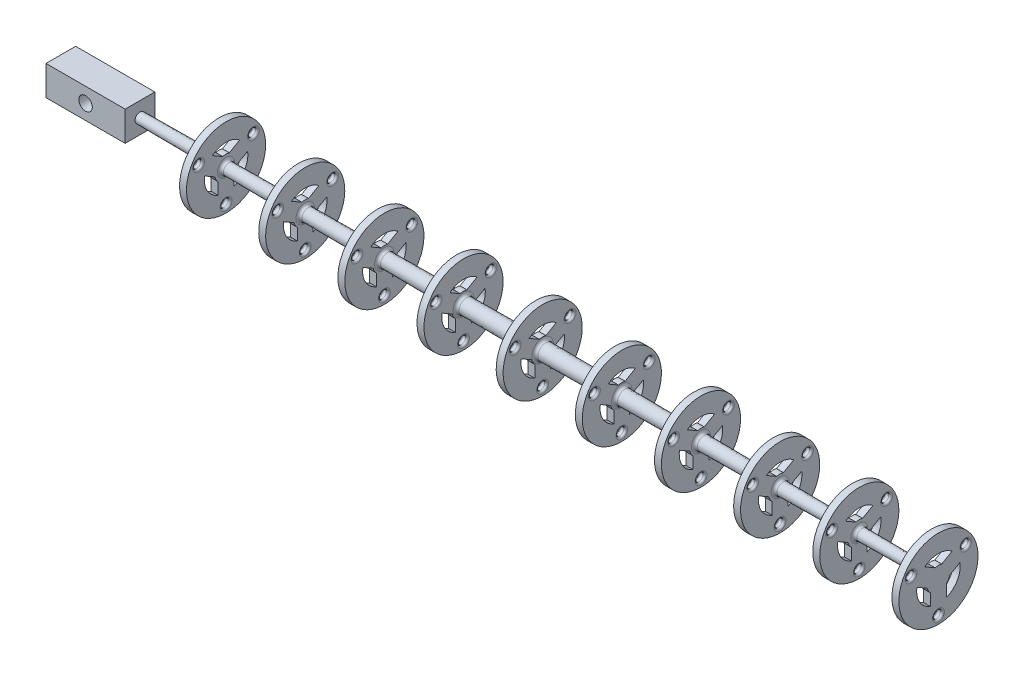
from build123d import *

# Parameters (mm, degrees)
SKETCH3_W                      = 1.75
SKETCH3_H                      = 10
CUT_EXTRUDE1_REACH             = 180.81
SKETCH5_R                      = 1
FILLET1_R                      = 0.5
LPATTERN1_COUNT                = 10
LPATTERN1_PITCH                = 20
FILLET1_OF_LPATTERN1_R         = 0.5
SKETCH16_W                     = 7.5
SKETCH16_H                     = 7.5
BOSS_EXTRUDE1_DEPTH            = 20
M3_CLEARANCE_HOLE1_D           = 3.4
M3_CLEARANCE_HOLE1_CSINK_D     = 3.45
M3_CLEARANCE_HOLE1_CSINK_ANGLE = 90
FILLET2_R                      = 0.75


with BuildPart() as part:
    # Sketch2 → Revolve1 (revolve)
    with BuildSketch(Plane.XY):
        Polygon((0, 1.25), (100, 2), (200, 1.25), (200, 0), (100, 0), (0, 0), align=None)
    revolve(axis=Axis((100, 0, 0), (-1, 0, 0)))

    # Sketch3 → Revolve2 (revolve)
    with BuildSketch(Plane.XY):
        with Locations((20.875, 5)):
            Rectangle(SKETCH3_W, SKETCH3_H)
    revolve2 = revolve(axis=Axis((21.75, 0, 0), (-1, 0, 0)))

    # Sketch5 → Cut-Extrude1 (cut, up to next)
    with BuildSketch(Plane(origin=(21.75, 0, 0), x_dir=(0, 0, -1), z_dir=(1, 0, 0)), mode=Mode.PRIVATE) as cut_extrude1_sk1:
        with Locations((0, -8)):
            Circle(SKETCH5_R)
    cut_extrude1_tool1 = extrude(cut_extrude1_sk1.sketch, amount=-CUT_EXTRUDE1_REACH, mode=Mode.PRIVATE) & part.part
    # Sketch5 → Cut-Extrude1 (cut, up to next)
    with BuildSketch(Plane(origin=(21.75, 0, 0), x_dir=(0, 0, -1), z_dir=(1, 0, 0)), mode=Mode.PRIVATE) as cut_extrude1_sk2:
        with Locations((6.92820323, 4)):
            Circle(SKETCH5_R)
    cut_extrude1_tool2 = extrude(cut_extrude1_sk2.sketch, amount=-CUT_EXTRUDE1_REACH, mode=Mode.PRIVATE) & part.part
    # Sketch5 → Cut-Extrude1 (cut, up to next)
    with BuildSketch(Plane(origin=(21.75, 0, 0), x_dir=(0, 0, -1), z_dir=(1, 0, 0)), mode=Mode.PRIVATE) as cut_extrude1_sk3:
        with Locations((-6.92820323, 4)):
            Circle(SKETCH5_R)
    cut_extrude1_tool3 = extrude(cut_extrude1_sk3.sketch, amount=-CUT_EXTRUDE1_REACH, mode=Mode.PRIVATE) & part.part
    # Sketch5 → Cut-Extrude1 (cut, up to next)
    with BuildSketch(Plane(origin=(21.75, 0, 0), x_dir=(0, 0, -1), z_dir=(1, 0, 0)), mode=Mode.PRIVATE) as cut_extrude1_sk4:
        with BuildLine():
            Line((-3.437059837, 4.293788499), (-0.834318116, 2.791094865))
            ThreePointArc((-0.834318116, 2.791094865), (0, 2.913125), (0.834318116, 2.791094865))
            Line((0.834318116, 2.791094865), (3.437059837, 4.293788499))
            ThreePointArc((3.437059837, 4.293788499), (0, 5.5), (-3.437059837, 4.293788499))
        make_face()
    cut_extrude1_tool4 = extrude(cut_extrude1_sk4.sketch, amount=-CUT_EXTRUDE1_REACH, mode=Mode.PRIVATE) & part.part
    # Sketch5 → Cut-Extrude1 (cut, up to next)
    with BuildSketch(Plane(origin=(21.75, 0, 0), x_dir=(0, 0, -1), z_dir=(1, 0, 0)), mode=Mode.PRIVATE) as cut_extrude1_sk5:
        with BuildLine():
            Line((2, -2.118088116), (2, -5.123475383))
            ThreePointArc((2, -5.123475383), (4.763139721, -2.75), (5.437059837, 0.829686884))
            Line((5.437059837, 0.829686884), (2.834318116, -0.67300675))
            ThreePointArc((2.834318116, -0.67300675), (2.522840254, -1.4565625), (2, -2.118088116))
        make_face()
    cut_extrude1_tool5 = extrude(cut_extrude1_sk5.sketch, amount=-CUT_EXTRUDE1_REACH, mode=Mode.PRIVATE) & part.part
    # Sketch5 → Cut-Extrude1 (cut, up to next)
    with BuildSketch(Plane(origin=(21.75, 0, 0), x_dir=(0, 0, -1), z_dir=(1, 0, 0)), mode=Mode.PRIVATE) as cut_extrude1_sk6:
        with BuildLine():
            Line((-2.834318116, -0.67300675), (-5.437059837, 0.829686884))
            ThreePointArc((-5.437059837, 0.829686884), (-4.763139721, -2.75), (-2, -5.123475383))
            Line((-2, -5.123475383), (-2, -2.118088116))
            ThreePointArc((-2, -2.118088116), (-2.522840254, -1.4565625), (-2.834318116, -0.67300675))
        make_face()
    cut_extrude1_tool6 = extrude(cut_extrude1_sk6.sketch, amount=-CUT_EXTRUDE1_REACH, mode=Mode.PRIVATE) & part.part
    cut_extrude1_1 = cut_extrude1_tool1.solids().sort_by_distance((21.75, -8, 0))[0]
    add(cut_extrude1_1, mode=Mode.SUBTRACT)
    cut_extrude1_2 = cut_extrude1_tool2.solids().sort_by_distance((21.75, 4, -6.928203))[0]
    add(cut_extrude1_2, mode=Mode.SUBTRACT)
    cut_extrude1_3 = cut_extrude1_tool3.solids().sort_by_distance((21.75, 4, 6.928203))[0]
    add(cut_extrude1_3, mode=Mode.SUBTRACT)
    cut_extrude1_4 = cut_extrude1_tool4.solids().sort_by_distance((21.75, 4.219627, 0))[0]
    add(cut_extrude1_4, mode=Mode.SUBTRACT)
    cut_extrude1_5 = cut_extrude1_tool5.solids().sort_by_distance((21.75, -2.109813, -3.654304))[0]
    add(cut_extrude1_5, mode=Mode.SUBTRACT)
    cut_extrude1_6 = cut_extrude1_tool6.solids().sort_by_distance((21.75, -2.109813, 3.654304))[0]
    add(cut_extrude1_6, mode=Mode.SUBTRACT)
    cut_extrude1 = cut_extrude1_1 + cut_extrude1_2 + cut_extrude1_3 + cut_extrude1_4 + cut_extrude1_5 + cut_extrude1_6  # Cut-Extrude1 as one shape, for the pattern or mirror that repeats it

    # Fillet1
    fillet1_edges = [part.edges().sort_by_distance(p)[0] for p in [
        (20, 4, -5.92820323),
        (20, -8, 1),
        (21.75, -8, 1),
        (21.75, 4, -5.92820323),
        (20, 4, 7.92820323),
        (21.75, 4, 7.92820323),
    ]]
    fillet(fillet1_edges, radius=FILLET1_R)

    # LPattern1: Revolve2, Cut-Extrude1 ×10
    with Locations(*[(i * LPATTERN1_PITCH, 0, 0) for i in range(1, LPATTERN1_COUNT)]):
        add(revolve2)
        add(cut_extrude1, mode=Mode.SUBTRACT)

    # Fillet1 of LPattern1
    fillet1_of_lpattern1_edges = [part.edges().sort_by_distance(p)[0] for p in [
        (40, 4, -5.92820323),
        (40, -8, 1),
        (41.75, -8, 1),
        (41.75, 4, -5.92820323),
        (40, 4, 7.92820323),
        (41.75, 4, 7.92820323),
        (60, 4, -5.92820323),
        (60, -8, 1),
        (61.75, -8, 1),
        (61.75, 4, -5.92820323),
        (60, 4, 7.92820323),
        (61.75, 4, 7.92820323),
        (80, 4, -5.92820323),
        (80, -8, 1),
        (81.75, -8, 1),
        (81.75, 4, -5.92820323),
        (80, 4, 7.92820323),
        (81.75, 4, 7.92820323),
        (100, 4, -5.92820323),
        (100, -8, 1),
        (101.75, -8, 1),
        (101.75, 4, -5.92820323),
        (100, 4, 7.92820323),
        (101.75, 4, 7.92820323),
        (120, 4, -5.92820323),
        (120, -8, 1),
        (121.75, -8, 1),
        (121.75, 4, -5.92820323),
        (120, 4, 7.92820323),
        (121.75, 4, 7.92820323),
        (140, 4, -5.92820323),
        (140, -8, 1),
        (141.75, -8, 1),
        (141.75, 4, -5.92820323),
        (140, 4, 7.92820323),
        (141.75, 4, 7.92820323),
        (160, 4, -5.92820323),
        (160, -8, 1),
        (161.75, -8, 1),
        (161.75, 4, -5.92820323),
        (160, 4, 7.92820323),
        (161.75, 4, 7.92820323),
        (180, 4, -5.92820323),
        (180, -8, 1),
        (181.75, -8, 1),
        (181.75, 4, -5.92820323),
        (180, 4, 7.92820323),
        (181.75, 4, 7.92820323),
        (200, 4, -5.92820323),
        (200, -8, 1),
        (201.75, -8, 1),
        (201.75, 4, -5.92820323),
        (200, 4, 7.92820323),
        (201.75, 4, 7.92820323),
    ]]
    fillet(fillet1_of_lpattern1_edges, radius=FILLET1_OF_LPATTERN1_R)

    # Sketch16 → Boss-Extrude1 (add)
    with BuildSketch(Plane.ZY):
        Rectangle(SKETCH16_W, SKETCH16_H)
    extrude(amount=BOSS_EXTRUDE1_DEPTH)

    # M3 Clearance Hole1 (through all)
    with Locations(Plane(origin=(0, 0, -3.75), x_dir=(-1, 0, 0), z_dir=(0, 0, -1))):
        with Locations((10, 0)):
            CounterSinkHole(M3_CLEARANCE_HOLE1_D / 2, M3_CLEARANCE_HOLE1_CSINK_D / 2, counter_sink_angle=M3_CLEARANCE_HOLE1_CSINK_ANGLE)

    # Fillet2
    fillet2_edges = [part.edges().sort_by_distance(p)[0] for p in [
        (20, -1.4, 0),
        (21.75, -1.413125, 0),
        (40, -1.55, 0),
        (41.75, -1.563125, 0),
        (60, -1.7, 0),
        (61.75, -1.713125, 0),
        (80, -1.85, 0),
        (81.75, -1.863125, 0),
        (100, -2, 0),
        (200, -1.25, 0),
        (181.75, -1.386875, 0),
        (180, -1.4, 0),
        (161.75, -1.536875, 0),
        (160, -1.55, 0),
        (141.75, -1.686875, 0),
        (140, -1.7, 0),
        (121.75, -1.836875, 0),
        (120, -1.85, 0),
        (101.75, -1.986875, 0),
    ]]
    fillet(fillet2_edges, radius=FILLET2_R)


solid = part.part
